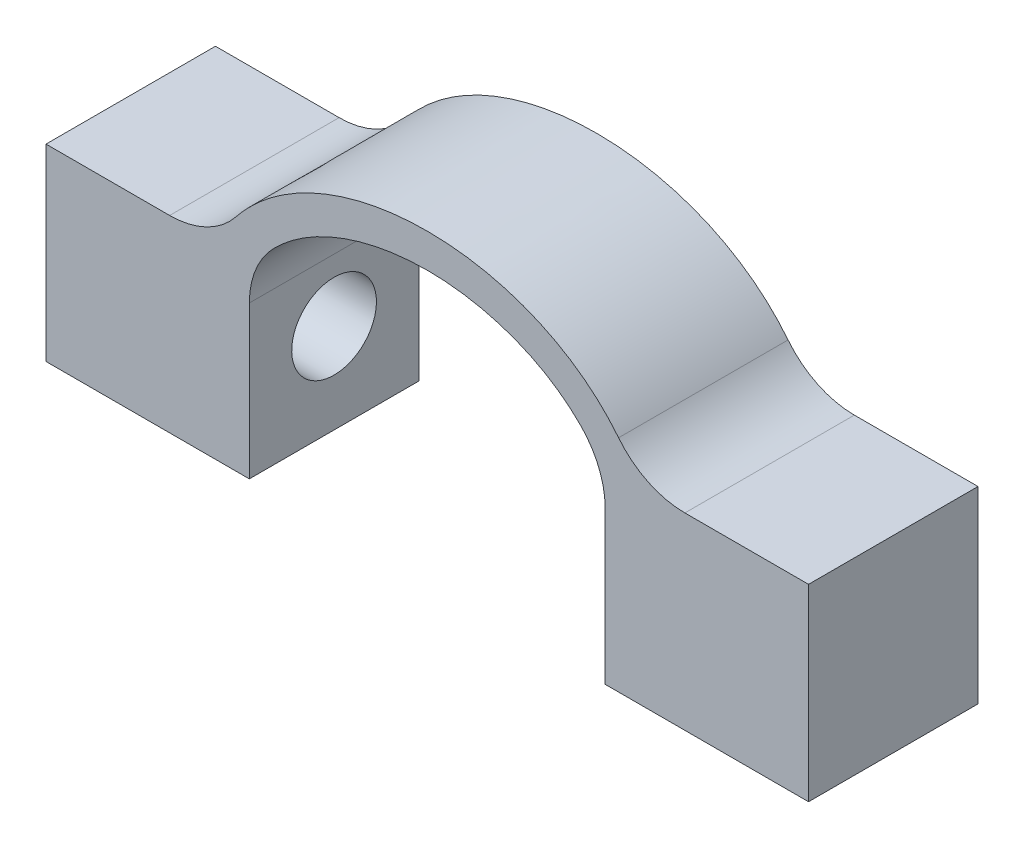
from build123d import *

# Parameters (mm, degrees)
BOSS_EXTRUDE1_DEPTH     = 10
CUT_EXTRUDE2_DEPTH      = 50.456381745
CUT_EXTRUDE2_DEPTH_BACK = 50.456381745
SKETCH3_R               = 2.5
CUT_EXTRUDE3_DEPTH      = 6
SKETCH4_R               = 2
CUT_REVOLVE1_ANGLE      = 90
SKETCH5_R               = 2
CUT_EXTRUDE4_DEPTH      = 2.805452299
FILLET1_R               = 5


with BuildPart() as part:
    # Sketch1 → Boss-Extrude1 (new body)
    with BuildSketch(Plane.XY):
        with BuildLine():
            Line((0, 0), (45, 0))
            Line((45, 0), (45, 11.1125))
            Line((45, 11.1125), (35, 11.1125))
            add(Edge.make_bspline(
                [(10, 11.1125), (14.576625097, 20.181995974), (30.423374903, 20.181995974), (35, 11.1125)],
                knots=[0, 0, 0, 0, 1, 1, 1, 1], degree=3))
            Line((10, 11.1125), (0, 11.1125))
            Line((0, 11.1125), (0, 0))
        make_face()
    extrude(amount=-BOSS_EXTRUDE1_DEPTH)

    # Sketch2 → Cut-Extrude2 (cut, two sides: drawn at the far end of the back side and taken through both)
    with BuildSketch(Plane.XY.offset(-CUT_EXTRUDE2_DEPTH_BACK)):
        with BuildLine():
            Line((33, 0), (33, 10.610904597))
            add(Edge.make_bspline(
                [(33, 10.610904597), (32.518518069, 11.455367364), (31.27134268, 12.982349636), (27.931157473, 15.20113612), (22.5, 16.390279221), (17.068842527, 15.20113612), (13.72865732, 12.982349636), (12.481481931, 11.455367364), (12, 10.610904597)],
                knots=[0.018308459, 0.018308459, 0.018308459, 0.018308459, 0.138731344, 0.25915423, 0.5, 0.74084577, 0.861268656, 0.981691541, 0.981691541, 0.981691541, 0.981691541], degree=3))
            Line((12, 10.610904597), (12, 0))
            Line((12, 0), (33, 0))
        make_face()
    extrude(amount=CUT_EXTRUDE2_DEPTH + CUT_EXTRUDE2_DEPTH_BACK, mode=Mode.SUBTRACT)

    # Sketch3 → Cut-Extrude3 (cut)
    with BuildSketch(Plane(origin=(12, 0, 0), x_dir=(0, 0, -1), z_dir=(1, 0, 0))):
        with Locations(Location((5, 5.305452299, 0), (0, 0, 90))):
            Circle(SKETCH3_R)
    cut_extrude3 = extrude(amount=-CUT_EXTRUDE3_DEPTH, mode=Mode.SUBTRACT)

    # Sketch4 → Cut-Revolve1 (revolve, cut)
    with BuildSketch(Plane(origin=(6, 0, 0), x_dir=(0, 0, -1), z_dir=(1, 0, 0))):
        with Locations((5, 5.305452299)):
            Circle(SKETCH4_R)
    cut_revolve1 = revolve(axis=Axis((6, 2.805452299, -5), (0, 0, 1)), revolution_arc=CUT_REVOLVE1_ANGLE, mode=Mode.SUBTRACT)

    # Sketch5 → Cut-Extrude4 (cut)
    with BuildSketch(Plane(origin=(0, 2.805452299, 0), x_dir=(1, 0, 0), z_dir=(0, 1, 0))):
        with Locations(Location((3.5, 5, 0), (0, 0, 180))):
            Circle(SKETCH5_R)
    cut_extrude4 = extrude(amount=-CUT_EXTRUDE4_DEPTH, mode=Mode.SUBTRACT)

    # Mirror1: Cut-Extrude3, Cut-Revolve1, Cut-Extrude4 across plane
    add(cut_extrude3.mirror(Plane(origin=(22.5, 0, 0), x_dir=(0, 0, 1), z_dir=(1, 0, 0))), mode=Mode.SUBTRACT)
    add(cut_revolve1.mirror(Plane(origin=(22.5, 0, 0), x_dir=(0, 0, 1), z_dir=(1, 0, 0))), mode=Mode.SUBTRACT)
    add(cut_extrude4.mirror(Plane(origin=(22.5, 0, 0), x_dir=(0, 0, 1), z_dir=(1, 0, 0))), mode=Mode.SUBTRACT)

    # Fillet1
    fillet1_edges = [part.edges().sort_by_distance(p)[0] for p in [
        (10, 11.1125, -5),
        (35, 11.1125, -5),
        (33, 10.610904597, -5),
        (12, 10.610904597, -5),
    ]]
    fillet(fillet1_edges, radius=FILLET1_R)


solid = part.part
